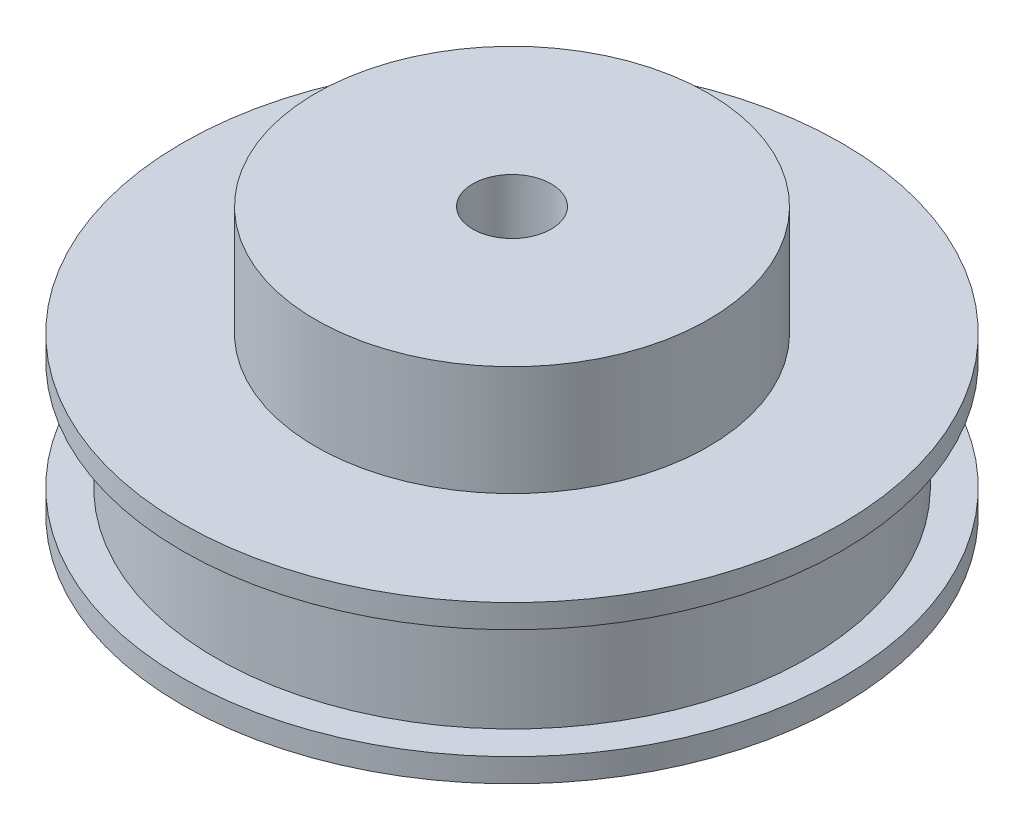
from build123d import *


with BuildPart() as part:
    # Sketch1 → Revolve1 (revolve)
    with BuildSketch(Plane.XY, mode=Mode.PRIVATE) as revolve1_sk:
        Polygon((2.5, 0), (2.5, 17), (12.5, 17), (12.5, 10), (21, 10), (21, 8.5), (18.84, 8.5), (18.84, 1.5), (21, 1.5), (21, 0), align=None)
    revolve(revolve1_sk.sketch.rotate(Axis((0, 0, 0), (0, 1, 0)), 90), axis=Axis((0, 0, 0), (0, 1, 0)))


solid = part.part
